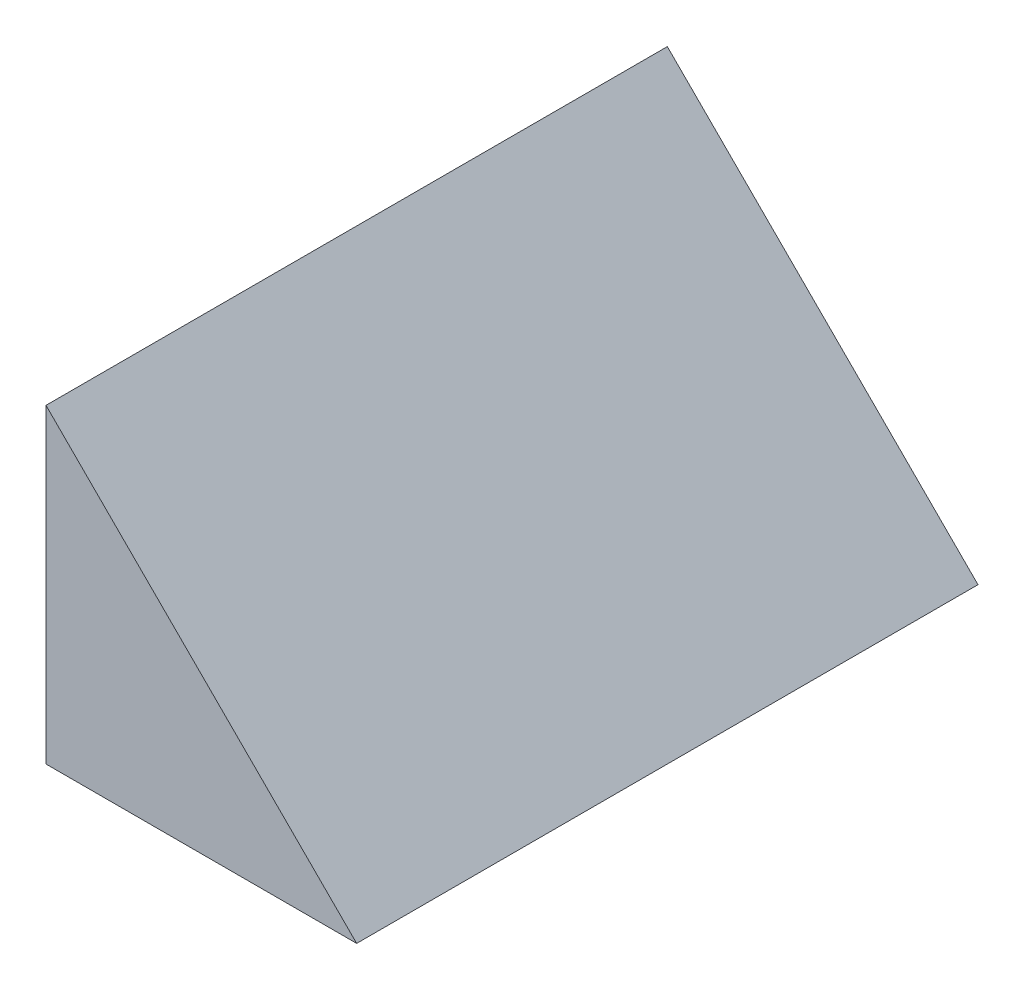
from build123d import *

# Parameters (mm, degrees)
BOSS_EXTRUDE1_DEPTH = 12.7


with BuildPart() as part:
    # Sketch1 → Boss-Extrude1 (new body)
    with BuildSketch(Plane.XY):
        Polygon((0, 0), (6.35, 0), (0, 6.35), align=None)
    extrude(amount=BOSS_EXTRUDE1_DEPTH)


solid = part.part
